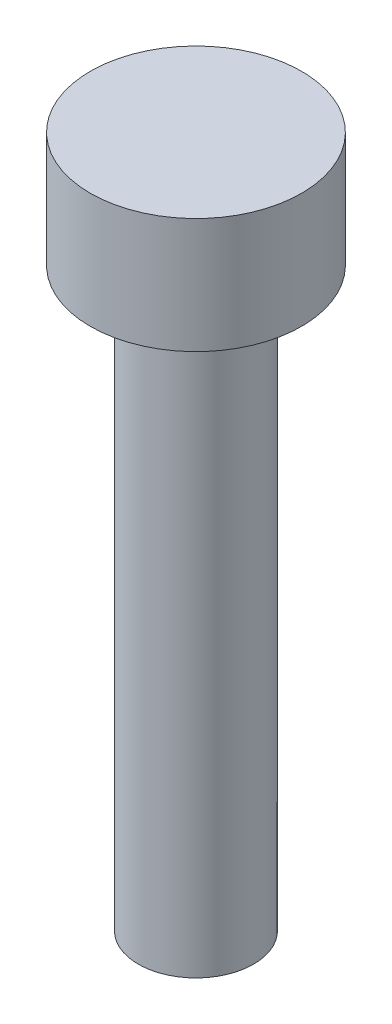
from build123d import *

# Parameters (mm, degrees)
SKETCH1_R           = 2.75
BOSS_EXTRUDE1_DEPTH = 3
SKETCH2_R           = 1.5
BOSS_EXTRUDE2_DEPTH = 15


with BuildPart() as part:
    # Sketch1 → Boss-Extrude1 (new body)
    with BuildSketch(Plane(origin=(0, 0, 0), x_dir=(1, 0, 0), z_dir=(0, 1, 0))):
        with Locations(Location((0, 0, 0), (0, 0, 270))):
            Circle(SKETCH1_R)
    extrude(amount=BOSS_EXTRUDE1_DEPTH)

    # Sketch2 → Boss-Extrude2 (add)
    with BuildSketch(Plane.XZ):
        with Locations(Location((0, 0, 0), (0, 0, 270))):
            Circle(SKETCH2_R)
    extrude(amount=BOSS_EXTRUDE2_DEPTH)


solid = part.part
